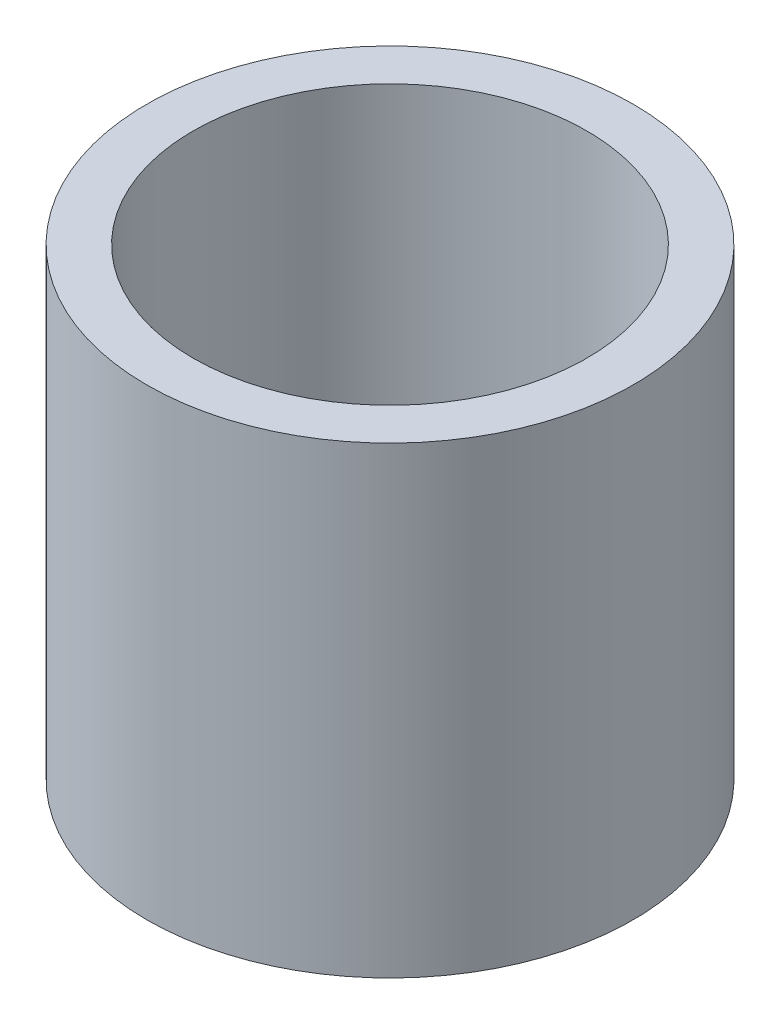
from build123d import *

# Parameters (mm, degrees)
SKETCH1_R           = 3.15
SKETCH1_R_2         = 2.55
BOSS_EXTRUDE1_DEPTH = 6


with BuildPart() as part:
    # Sketch1 → Boss-Extrude1 (new body)
    with BuildSketch(Plane(origin=(0, 0, 0), x_dir=(1, 0, 0), z_dir=(0, 1, 0))):
        with Locations(Location((0, 0, 0), (0, 0, 270))):
            Circle(SKETCH1_R)
        with Locations(Location((0, 0, 0), (0, 0, 270))):
            Circle(SKETCH1_R_2, mode=Mode.SUBTRACT)
    extrude(amount=BOSS_EXTRUDE1_DEPTH)


solid = part.part
